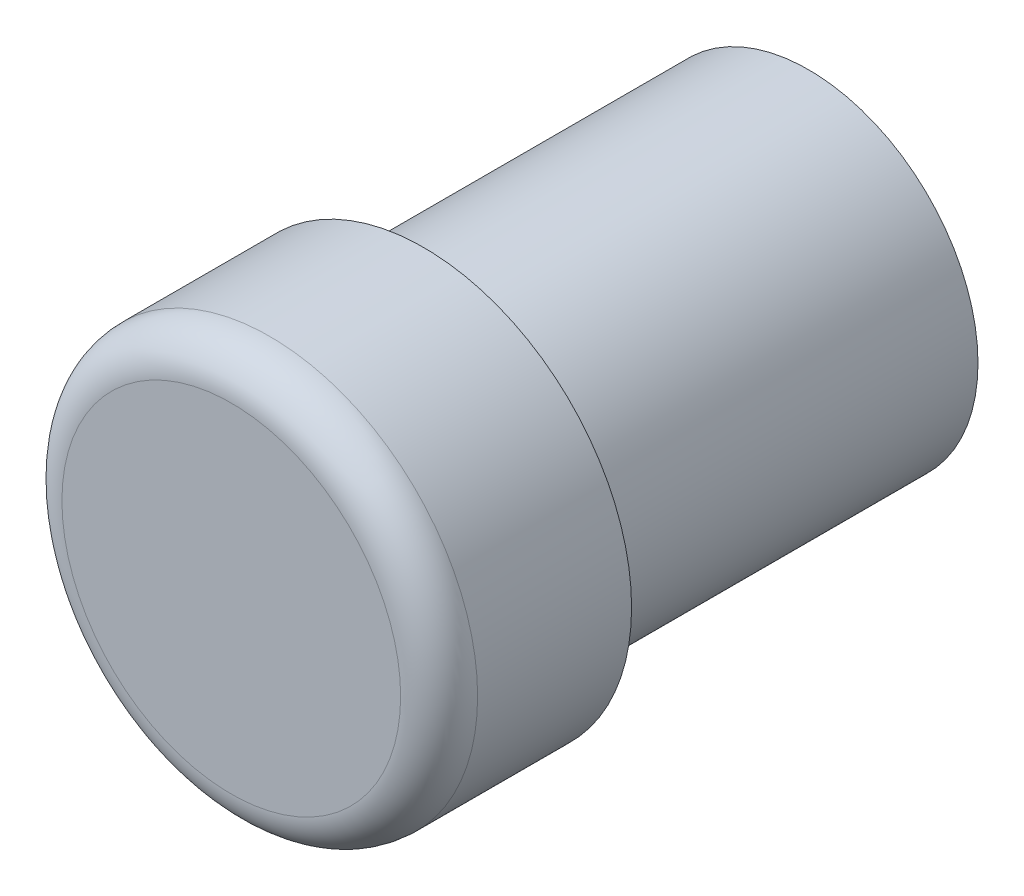
from build123d import *

# Parameters (mm, degrees)
SKETCH_1_R          = 10.8
EXTRUDE_1_DEPTH     = 10
SKETCH_2_R          = 8.8
EXTRUDE_2_DEPTH     = 20
FILLET_1_R          = 2
SKETCH_3_R          = 2
CUT_EXTRUDE_1_DEPTH = 10


with BuildPart() as part:
    # 草图1 → 凸台-拉伸1 (new body)
    with BuildSketch(Plane.XY):
        Circle(SKETCH_1_R)
    extrude(amount=EXTRUDE_1_DEPTH)

    # 草图2 → 凸台-拉伸2 (add)
    with BuildSketch(Plane(origin=(0, 0, 0), x_dir=(-1, 0, 0), z_dir=(0, 0, -1))):
        Circle(SKETCH_2_R)
    extrude(amount=EXTRUDE_2_DEPTH)

    # 圆角1
    fillet_1_edges = [part.edges().sort_by_distance(p)[0] for p in [
        (-10.8, 0, 10),
    ]]
    fillet(fillet_1_edges, radius=FILLET_1_R)

    # 草图3 → 切除-拉伸1 (cut)
    with BuildSketch(Plane(origin=(0, 0, -20), x_dir=(-1, 0, 0), z_dir=(0, 0, -1))):
        Circle(SKETCH_3_R)
    extrude(amount=-CUT_EXTRUDE_1_DEPTH, mode=Mode.SUBTRACT)


solid = part.part
